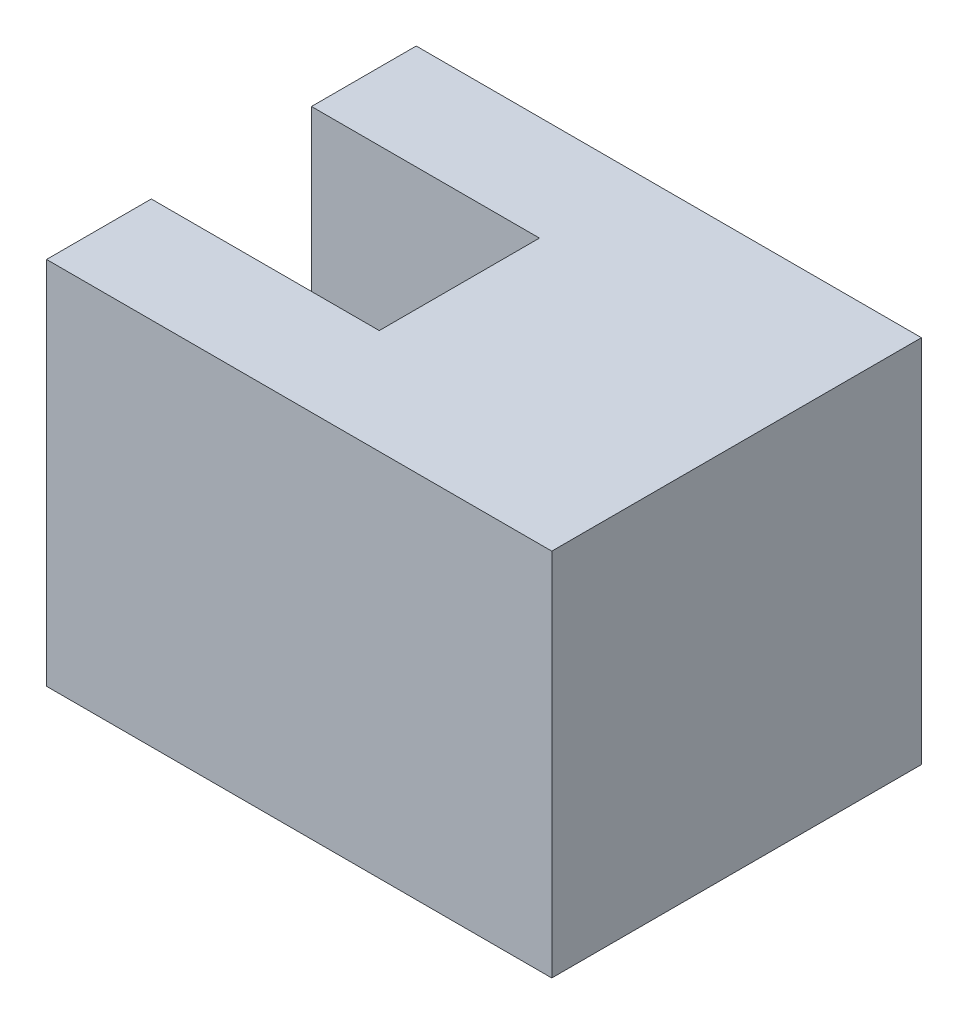
from build123d import *

# Parameters (mm, degrees)
BOSS_EXTRUDE1_DEPTH = 3


with BuildPart() as part:
    # Sketch1 → Boss-Extrude1 (new body)
    with BuildSketch(Plane(origin=(0, 0, 0), x_dir=(1, 0, 0), z_dir=(0, 1, 0))):
        Polygon((0, 0), (4.1, 0), (4.1, 3), (0, 3), (0, 2.15), (1.85, 2.15), (1.85, 0.85), (0, 0.85), align=None)
    extrude(amount=BOSS_EXTRUDE1_DEPTH)


solid = part.part
